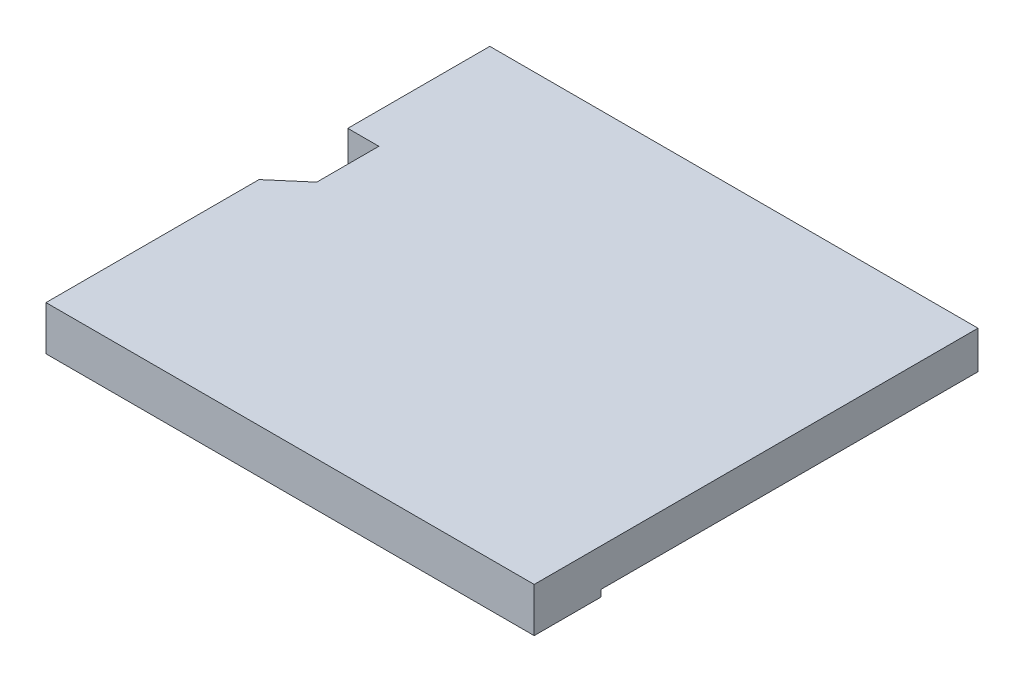
from build123d import *

# Parameters (mm, degrees)
SKETCH1_W           = 9.849999945
SKETCH1_H           = 0.849999995
BOSS_EXTRUDE1_DEPTH = 10
BOSS_EXTRUDE2_DEPTH = 0.849999995
BOSS_EXTRUDE3_DEPTH = 0.150000005


with BuildPart() as part:
    # Sketch1 → Boss-Extrude1 (new body)
    with BuildSketch(Plane.XY):
        with Locations((2.94e-07, -2.739426966)):
            Rectangle(SKETCH1_W, SKETCH1_H)
    extrude(amount=BOSS_EXTRUDE1_DEPTH)

    # Sketch3 → Boss-Extrude2 (add)
    with BuildSketch(Plane.XZ.offset(3.164426964)):
        Polygon((-4.924999678, 0), (-4.924999678, 10), (-6.074999733, 10), (-6.074999733, 5.2), (-5.374999733, 4.6), (-5.374999733, 3.2), (-6.074999733, 3.2), (-6.074999733, 0), align=None)
    extrude(amount=-BOSS_EXTRUDE2_DEPTH)

    # Sketch4 → Boss-Extrude3 (add)
    with BuildSketch(Plane.XZ.offset(3.164426964)):
        with BuildLine():
            Line((-6.074999733, 10), (4.925000267, 10))
            Line((4.925000267, 10), (4.925000267, 8.5))
            ThreePointArc((4.925000267, 8.5), (-0.574999733, 8.25), (-6.074999733, 8.5))
            Line((-6.074999733, 8.5), (-6.074999733, 10))
        make_face()
    extrude(amount=BOSS_EXTRUDE3_DEPTH)


solid = part.part
